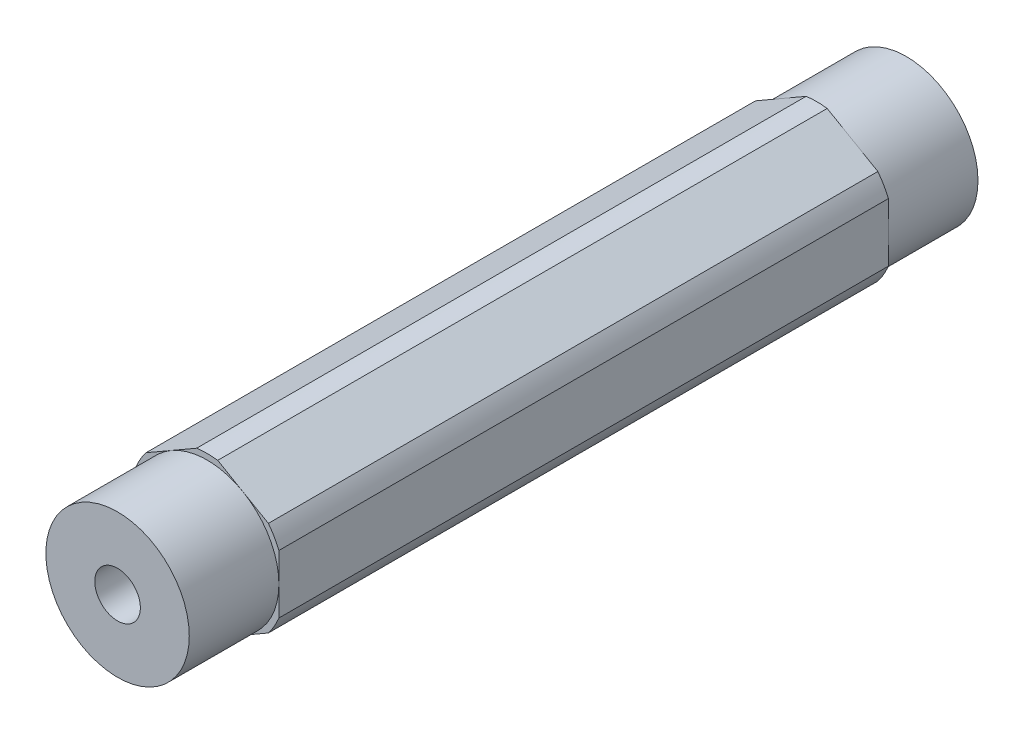
from build123d import *

# Parameters (mm, degrees)
SKETCH1_R           = 2.0193
BOSS_EXTRUDE1_DEPTH = 26.9875
SKETCH2_R           = 6.35
SKETCH2_R_2         = 2.0193
BOSS_EXTRUDE2_DEPTH = 7.9375


with BuildPart() as part:
    # Sketch1 → Boss-Extrude1 (new, symmetric)
    with BuildSketch(Plane.XY):
        with BuildLine():
            ThreePointArc((0.93173274, 6.79441227), (0, 6.858), (-0.93173274, 6.79441227))
            Line((-0.93173274, 6.79441227), (-5.41826726, 4.204110358))
            ThreePointArc((-5.41826726, 4.204110358), (-5.939202219, 3.429), (-6.35, 2.590301913))
            Line((-6.35, 2.590301913), (-6.35, -2.590301913))
            ThreePointArc((-6.35, -2.590301913), (-5.939202219, -3.429), (-5.41826726, -4.204110358))
            Line((-5.41826726, -4.204110358), (-0.93173274, -6.79441227))
            ThreePointArc((-0.93173274, -6.79441227), (0, -6.858), (0.93173274, -6.79441227))
            Line((0.93173274, -6.79441227), (5.41826726, -4.204110358))
            ThreePointArc((5.41826726, -4.204110358), (5.939202219, -3.429), (6.35, -2.590301913))
            Line((6.35, -2.590301913), (6.35, 2.590301913))
            ThreePointArc((6.35, 2.590301913), (5.939202219, 3.429), (5.41826726, 4.204110358))
            Line((5.41826726, 4.204110358), (0.93173274, 6.79441227))
        make_face()
        Circle(SKETCH1_R, mode=Mode.SUBTRACT)
    extrude(amount=BOSS_EXTRUDE1_DEPTH, both=True)

    # Sketch2 → Boss-Extrude2 (add)
    with BuildSketch(Plane.XY.offset(26.9875)):
        Circle(SKETCH2_R)
        Circle(SKETCH2_R_2, mode=Mode.SUBTRACT)
    boss_extrude2 = extrude(amount=BOSS_EXTRUDE2_DEPTH)

    # Mirror1: Boss-Extrude2 across plane
    add(boss_extrude2.mirror(Plane.XY))


solid = part.part
